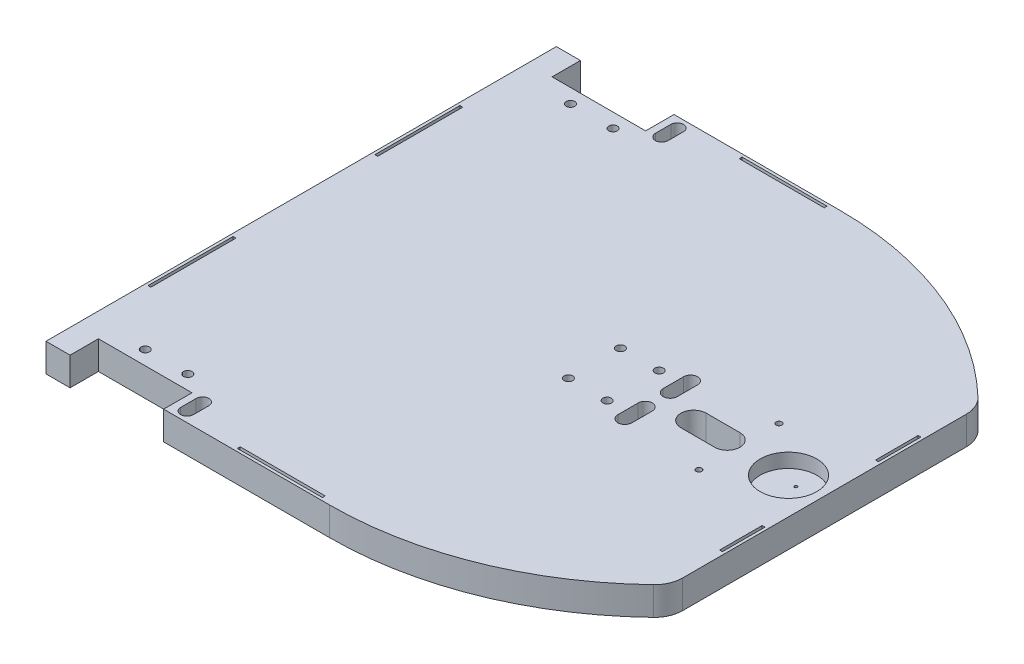
from build123d import *

# Parameters (mm, degrees)
BOSS_EXTRUDE1_DEPTH = 10
SKETCH2_R           = 1
SKETCH2_R_2         = 1.5
SKETCH2_W           = 33
SKETCH2_H           = 10
CUT_EXTRUDE2_DEPTH  = 15
SKETCH3_R           = 10
CUT_EXTRUDE3_DEPTH  = 5
CUT_EXTRUDE4_DEPTH  = 15
SKETCH5_W           = 30
SKETCH5_H           = 1
SKETCH5_W_2         = 1
SKETCH5_H_2         = 30
SKETCH5_H_3         = 15
CUT_EXTRUDE6_DEPTH  = 15
SKETCH6_R           = 0.5
CUT_EXTRUDE7_DEPTH  = 15
SKETCH7_R           = 1.5
CUT_EXTRUDE8_DEPTH  = 132.376296717


with BuildPart() as part:
    # Sketch1 → Boss-Extrude1 (new body)
    with BuildSketch(Plane(origin=(0, 0, 0), x_dir=(1, 0, 0), z_dir=(0, 1, 0))):
        with BuildLine():
            Line((-89.389143795, -90), (-89.389143795, 90))
            Line((-89.389143795, 90), (10.610856205, 90))
            ThreePointArc((10.610856205, 90), (54.533138364, 81.496268076), (92.107774725, 57.214031174))
            ThreePointArc((92.107774725, 57.214031174), (94.381847518, 53.920998768), (95.182620993, 50))
            Line((95.182620993, 50), (95.182620993, -50))
            ThreePointArc((95.182620993, -50), (94.381847518, -53.920998768), (92.107774725, -57.214031174))
            ThreePointArc((92.107774725, -57.214031174), (54.533138364, -81.496268076), (10.610856205, -90))
            Line((10.610856205, -90), (-89.389143795, -90))
        make_face()
    extrude(amount=BOSS_EXTRUDE1_DEPTH)

    # Sketch2 → Cut-Extrude2 (cut, symmetric)
    with BuildSketch(Plane(origin=(0, 10, 0), x_dir=(1, 0, 0), z_dir=(0, 1, 0))):
        with Locations(Location((65, 14.131573434, 0), (0, 0, 90))):
            Circle(SKETCH2_R)
        with Locations(Location((27.688972694, 9.173126615, 0), (0, 0, 90))):
            Circle(SKETCH2_R_2)
        with Locations(Location((14.053243942, 9.173126615, 0), (0, 0, 90))):
            Circle(SKETCH2_R_2)
        with Locations(Location((14.053243942, -9.173126615, 0), (0, 0, 90))):
            Circle(SKETCH2_R_2)
        with Locations(Location((27.688972694, -9.173126615, 0), (0, 0, 90))):
            Circle(SKETCH2_R_2)
        with Locations(Location((65, -14.131573434, 0), (0, 0, 90))):
            Circle(SKETCH2_R)
        with BuildLine():
            Line((-40.968894473, 86.42714575), (-40.968894473, 80.97285425))
            ThreePointArc((-40.968894473, 80.97285425), (-43.204350858, 78.737397865), (-45.439807243, 80.97285425))
            Line((-45.439807243, 80.97285425), (-45.439807243, 86.42714575))
            ThreePointArc((-45.439807243, 86.42714575), (-43.204350858, 88.662602135), (-40.968894473, 86.42714575))
        make_face()
        with BuildLine():
            Line((38.845478036, 11.594873944), (38.845478036, 4.405126056))
            ThreePointArc((38.845478036, 4.405126056), (36.366254627, 1.925902647), (33.887031217, 4.405126056))
            Line((33.887031217, 4.405126056), (33.887031217, 11.594873944))
            ThreePointArc((33.887031217, 11.594873944), (36.366254627, 14.074097353), (38.845478036, 11.594873944))
        make_face()
        with Locations((-64.401012641, 85)):
            Rectangle(SKETCH2_W, SKETCH2_H)
        with BuildLine():
            Line((38.845478036, -11.594873944), (38.845478036, -4.405126056))
            ThreePointArc((38.845478036, -4.405126056), (36.366254627, -1.925902647), (33.887031217, -4.405126056))
            Line((33.887031217, -4.405126056), (33.887031217, -11.594873944))
            ThreePointArc((33.887031217, -11.594873944), (36.366254627, -14.074097353), (38.845478036, -11.594873944))
        make_face()
        with BuildLine():
            Line((-40.968894473, -86.42714575), (-40.968894473, -80.97285425))
            ThreePointArc((-40.968894473, -80.97285425), (-43.204350858, -78.737397865), (-45.439807243, -80.97285425))
            Line((-45.439807243, -80.97285425), (-45.439807243, -86.42714575))
            ThreePointArc((-45.439807243, -86.42714575), (-43.204350858, -88.662602135), (-40.968894473, -86.42714575))
        make_face()
        with Locations((-64.401012641, -85)):
            Rectangle(SKETCH2_W, SKETCH2_H)
    extrude(amount=CUT_EXTRUDE2_DEPTH, both=True, mode=Mode.SUBTRACT)

    # Sketch3 → Cut-Extrude3 (cut, symmetric)
    with BuildSketch(Plane(origin=(0, 10, 0), x_dir=(1, 0, 0), z_dir=(0, 1, 0))):
        with Locations(Location((82.479810043, 0, 0), (0, 0, 270))):
            Circle(SKETCH3_R)
    extrude(amount=CUT_EXTRUDE3_DEPTH, both=True, mode=Mode.SUBTRACT)

    # Sketch4 → Cut-Extrude4 (cut, symmetric)
    with BuildSketch(Plane(origin=(0, 10, 0), x_dir=(1, 0, 0), z_dir=(0, 1, 0))):
        with BuildLine():
            Line((49.010294015, 4.462602137), (60.91056638, 4.462602137))
            ThreePointArc((60.91056638, 4.462602137), (65.373168517, 0), (60.91056638, -4.462602137))
            Line((60.91056638, -4.462602137), (49.010294015, -4.462602137))
            ThreePointArc((49.010294015, -4.462602137), (44.547691878, 0), (49.010294015, 4.462602137))
        make_face()
    extrude(amount=CUT_EXTRUDE4_DEPTH, both=True, mode=Mode.SUBTRACT)

    # Sketch5 → Cut-Extrude6 (cut, symmetric)
    with BuildSketch(Plane(origin=(0, 10, 0), x_dir=(1, 0, 0), z_dir=(0, 1, 0))):
        with Locations((-7.901012641, 88.5)):
            Rectangle(SKETCH5_W, SKETCH5_H)
        with Locations((-87.889143795, 40)):
            Rectangle(SKETCH5_W_2, SKETCH5_H_2)
        with Locations((93.682620993, 27.5)):
            Rectangle(SKETCH5_W_2, SKETCH5_H_3)
        with Locations((93.682620993, -27.5)):
            Rectangle(SKETCH5_W_2, SKETCH5_H_3)
        with Locations((-7.901012641, -88.5)):
            Rectangle(SKETCH5_W, SKETCH5_H)
        with Locations((-87.889143795, -40)):
            Rectangle(SKETCH5_W_2, SKETCH5_H_2)
    extrude(amount=CUT_EXTRUDE6_DEPTH, both=True, mode=Mode.SUBTRACT)

    # Sketch6 → Cut-Extrude7 (cut, symmetric)
    with BuildSketch(Plane(origin=(0, 5, 0), x_dir=(1, 0, 0), z_dir=(0, 1, 0))):
        with Locations(Location((82.244112685, 2.835581496, 0), (0, 0, 270))):
            Circle(SKETCH6_R)
        with Locations(Location((82.244112685, -5.164418504, 0), (0, 0, 270))):
            Circle(SKETCH6_R)
    extrude(amount=CUT_EXTRUDE7_DEPTH, both=True, mode=Mode.SUBTRACT)

    # Sketch7 → Cut-Extrude8 (cut, through all)
    with BuildSketch(Plane(origin=(0, 10, 0), x_dir=(1, 0, 0), z_dir=(0, 1, 0))):
        with Locations(Location((-69.389143795, 75, 0), (0, 0, 270))):
            Circle(SKETCH7_R)
        with Locations(Location((-54.389143795, 75, 0), (0, 0, 270))):
            Circle(SKETCH7_R)
        with Locations(Location((-69.389143795, -75, 0), (0, 0, 270))):
            Circle(SKETCH7_R)
        with Locations(Location((-54.389143795, -75, 0), (0, 0, 270))):
            Circle(SKETCH7_R)
    extrude(amount=-CUT_EXTRUDE8_DEPTH, mode=Mode.SUBTRACT)


solid = part.part
